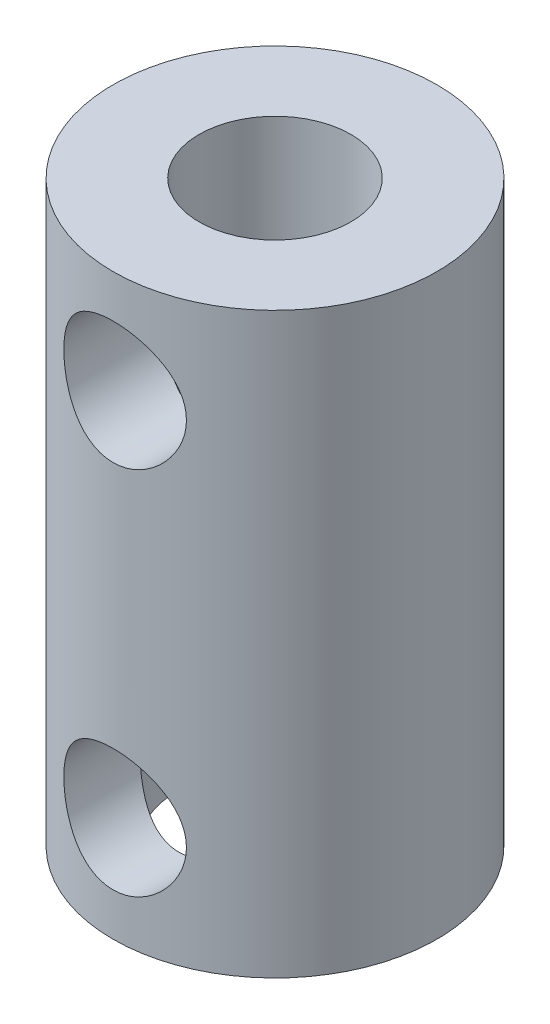
from build123d import *

# Parameters (mm, degrees)
SKETCH1_W                   = 5.334
SKETCH1_H                   = 19.05
M3_5_CLEARANCE_HOLE1_REACH  = 21.654
M3_5_CLEARANCE_HOLE1_BORE_R = 2.0193
M3_5_CLEARANCE_HOLE2_REACH  = 21.654
M3_5_CLEARANCE_HOLE2_BORE_R = 2.0193


with BuildPart() as part:
    # Sketch1 → Revolve1 (revolve)
    with BuildSketch(Plane.XY, mode=Mode.PRIVATE) as revolve1_sk:
        with Locations((2.667, 9.525)):
            Rectangle(SKETCH1_W, SKETCH1_H)
    revolve(revolve1_sk.sketch.rotate(Axis((0, 19.05, 0), (0, -1, 0)), 270), axis=Axis((0, 19.05, 0), (0, -1, 0)))

    # Sketch2 → Hole1 (revolve, cut)
    with BuildSketch(Plane(origin=(0, 0, 0), x_dir=(0, 0, -1), z_dir=(1, 0, 0))):
        Polygon((0, 0), (0, 19.05), (2.5, 19.05), (2.5, 9.930580918), (3.175, 9.525), (3.175, 0), align=None)
    revolve(axis=Axis((0, -6.130023899, 0), (0, 1, 0)), mode=Mode.SUBTRACT)

    # M3.5 Clearance Hole1 bore (on position points) → M3.5 Clearance Hole1 (cut, up to next)
    with BuildSketch(Plane(origin=(0, 15.621, 5.334), x_dir=(1, 0, 0), z_dir=(0, 0, 1)), mode=Mode.PRIVATE) as m3_5_clearance_hole1_sk1:
        Circle(M3_5_CLEARANCE_HOLE1_BORE_R)
    m3_5_clearance_hole1_tool1 = extrude(m3_5_clearance_hole1_sk1.sketch, amount=-M3_5_CLEARANCE_HOLE1_REACH, mode=Mode.PRIVATE) & part.part
    add(m3_5_clearance_hole1_tool1.solids().sort_by_distance((0, 15.621, 5.334))[0], mode=Mode.SUBTRACT)

    # M3.5 Clearance Hole2 bore (on position points) → M3.5 Clearance Hole2 (cut, up to next)
    with BuildSketch(Plane(origin=(0, 3.429, 5.334), x_dir=(1, 0, 0), z_dir=(0, 0, 1)), mode=Mode.PRIVATE) as m3_5_clearance_hole2_sk1:
        Circle(M3_5_CLEARANCE_HOLE2_BORE_R)
    m3_5_clearance_hole2_tool1 = extrude(m3_5_clearance_hole2_sk1.sketch, amount=-M3_5_CLEARANCE_HOLE2_REACH, mode=Mode.PRIVATE) & part.part
    add(m3_5_clearance_hole2_tool1.solids().sort_by_distance((0, 3.429, 5.334))[0], mode=Mode.SUBTRACT)


solid = part.part
